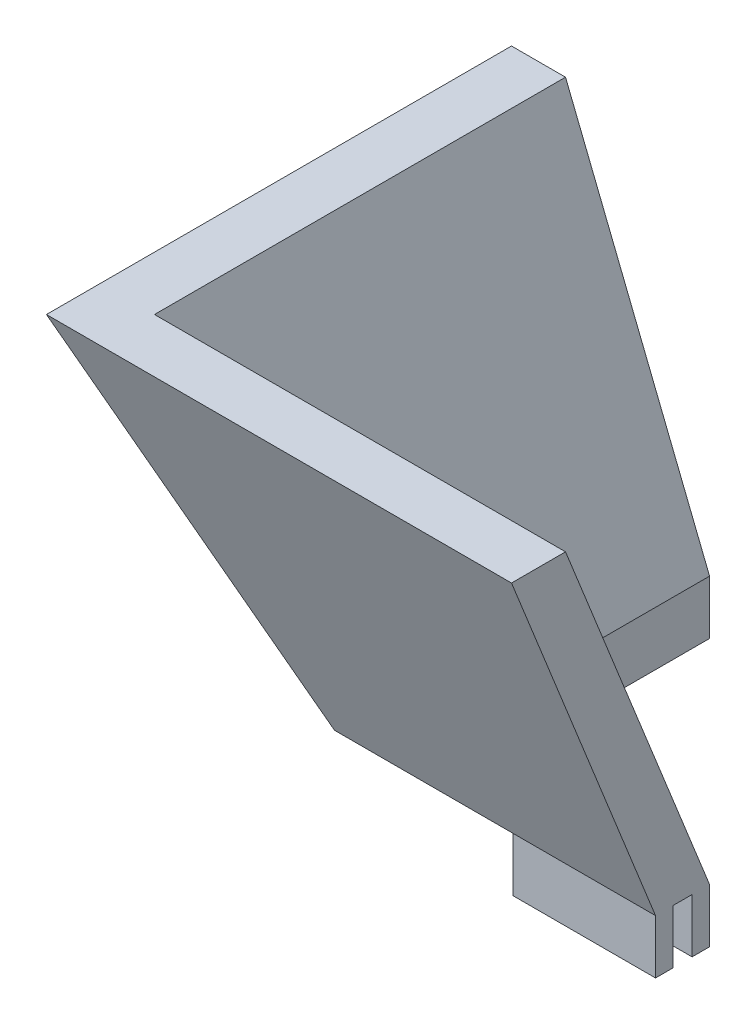
from build123d import *

# Parameters (mm, degrees)
SKETCH5_W           = 6.1595
SKETCH5_H           = 101.6
SKETCH5_W_2         = 101.6
SKETCH5_H_2         = 6.1595
BOSS_EXTRUDE1_DEPTH = 19.05
SKETCH6_W           = 333.025633445
SKETCH6_H           = 150.821732437
CUT_EXTRUDE1_DEPTH  = 205.486
SKETCH7_W           = 172.839732196
SKETCH7_H           = 155.996881263
CUT_EXTRUDE2_DEPTH  = 205.486


with BuildPart() as part:
    # Sketch2 → Loft1 section 0
    with BuildSketch(Plane(origin=(0, 127, 0), x_dir=(1, 0, 0), z_dir=(0, 1, 0))):
        with BuildLine():
            Line((-50.8, -50.8), (278.13, -50.8))
            Line((278.13, -50.8), (278.13, 276.352))
            Line((278.13, 276.352), (-50.8, 276.352))
            Line((-50.8, 276.352), (-50.8, -50.8))
        make_face()
    # Sketch1 → Loft1 section 1
    with BuildSketch(Plane(origin=(0, 0, 0), x_dir=(1, 0, 0), z_dir=(0, 1, 0))):
        with BuildLine():
            Line((0, 0), (227.33, 0))
            Line((227.33, 0), (227.33, 225.552))
            Line((227.33, 225.552), (0, 225.552))
            Line((0, 225.552), (0, 0))
        make_face()
    loft()

    # Sketch4 → Cut-Loft3 section 0
    with BuildSketch(Plane.XZ):
        with BuildLine():
            Line((208.28, -19.05), (19.05, -19.05))
            Line((19.05, -19.05), (19.05, -206.502))
            Line((19.05, -206.502), (208.28, -206.502))
            Line((208.28, -206.502), (208.28, -19.05))
        make_face()
    # Sketch3 → Cut-Loft3 section 1
    with BuildSketch(Plane(origin=(0, 127, 0), x_dir=(1, 0, 0), z_dir=(0, 1, 0))):
        with BuildLine():
            Line((-31.75, 257.302), (-31.75, -31.75))
            Line((-31.75, -31.75), (259.08, -31.75))
            Line((259.08, -31.75), (259.08, 257.302))
            Line((259.08, 257.302), (-31.75, 257.302))
        make_face()
    loft(mode=Mode.SUBTRACT)

    # Sketch5 → Boss-Extrude1 (add)
    with BuildSketch(Plane.XZ):
        with Locations((3.07975, -112.776)):
            Rectangle(SKETCH5_W, SKETCH5_H)
        with Locations((15.97025, -112.776)):
            Rectangle(SKETCH5_W, SKETCH5_H)
        with Locations((113.665, -3.07975)):
            Rectangle(SKETCH5_W_2, SKETCH5_H_2)
        with Locations((113.665, -15.97025)):
            Rectangle(SKETCH5_W_2, SKETCH5_H_2)
        with Locations((223.36125, -113.665)):
            Rectangle(SKETCH5_W, SKETCH5_H)
        with Locations((210.47075, -113.665)):
            Rectangle(SKETCH5_W, SKETCH5_H)
        with Locations((112.776, -223.36125)):
            Rectangle(SKETCH5_W_2, SKETCH5_H_2)
        with Locations((112.776, -210.47075)):
            Rectangle(SKETCH5_W_2, SKETCH5_H_2)
    extrude(amount=BOSS_EXTRUDE1_DEPTH)

    # Sketch6 → Cut-Extrude1 (cut)
    with BuildSketch(Plane.XY.offset(-113.2205)):
        with Locations((111.617183278, 51.589133782)):
            Rectangle(SKETCH6_W, SKETCH6_H)
    extrude(amount=-CUT_EXTRUDE1_DEPTH, mode=Mode.SUBTRACT)

    # Sketch7 → Cut-Extrude2 (cut)
    with BuildSketch(Plane.ZY.offset(-113.2205)):
        with Locations((-29.906934154, 52.245596061)):
            Rectangle(SKETCH7_W, SKETCH7_H)
    extrude(amount=-CUT_EXTRUDE2_DEPTH, mode=Mode.SUBTRACT)


solid = part.part
